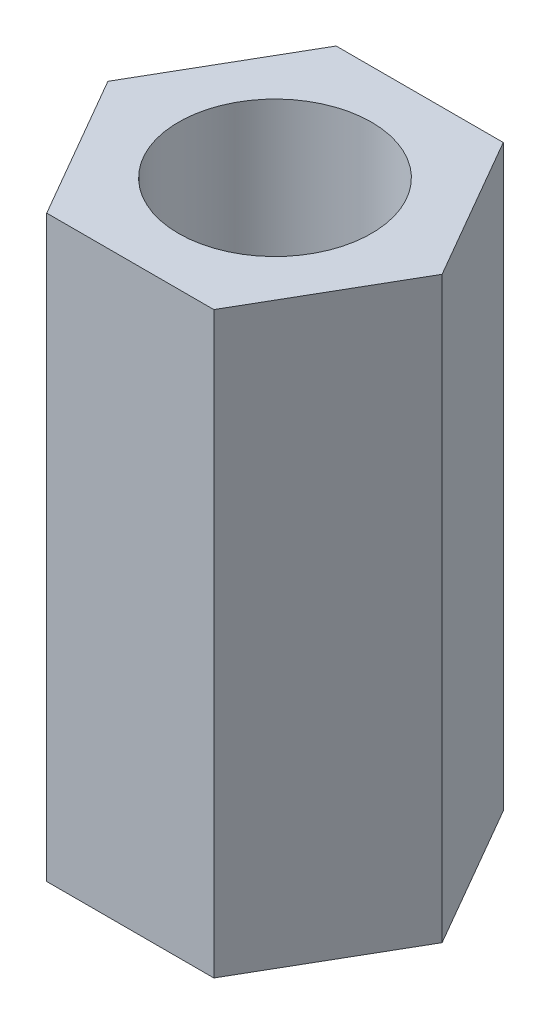
from build123d import *

# Parameters (mm, degrees)
EXTRUDE_1_DEPTH     = 6
SKETCH_2_R          = 1
CUT_EXTRUDE_1_DEPTH = 7.422616289


with BuildPart() as part:
    # 草图1 → 凸台-拉伸1 (new body)
    with BuildSketch(Plane(origin=(0, 0, 0), x_dir=(1, 0, 0), z_dir=(0, 1, 0))):
        Polygon((1.732050808, 0), (0.866025404, 1.5), (-0.866025404, 1.5), (-1.732050808, 0), (-0.866025404, -1.5), (0.866025404, -1.5), align=None)
    extrude(amount=EXTRUDE_1_DEPTH)

    # 草图2 → 切除-拉伸1 (cut, through all)
    with BuildSketch(Plane(origin=(0, 6, 0), x_dir=(1, 0, 0), z_dir=(0, 1, 0))):
        with Locations(Location((0, 0, 0), (0, 0, 270))):
            Circle(SKETCH_2_R)
    extrude(amount=-CUT_EXTRUDE_1_DEPTH, mode=Mode.SUBTRACT)


solid = part.part
